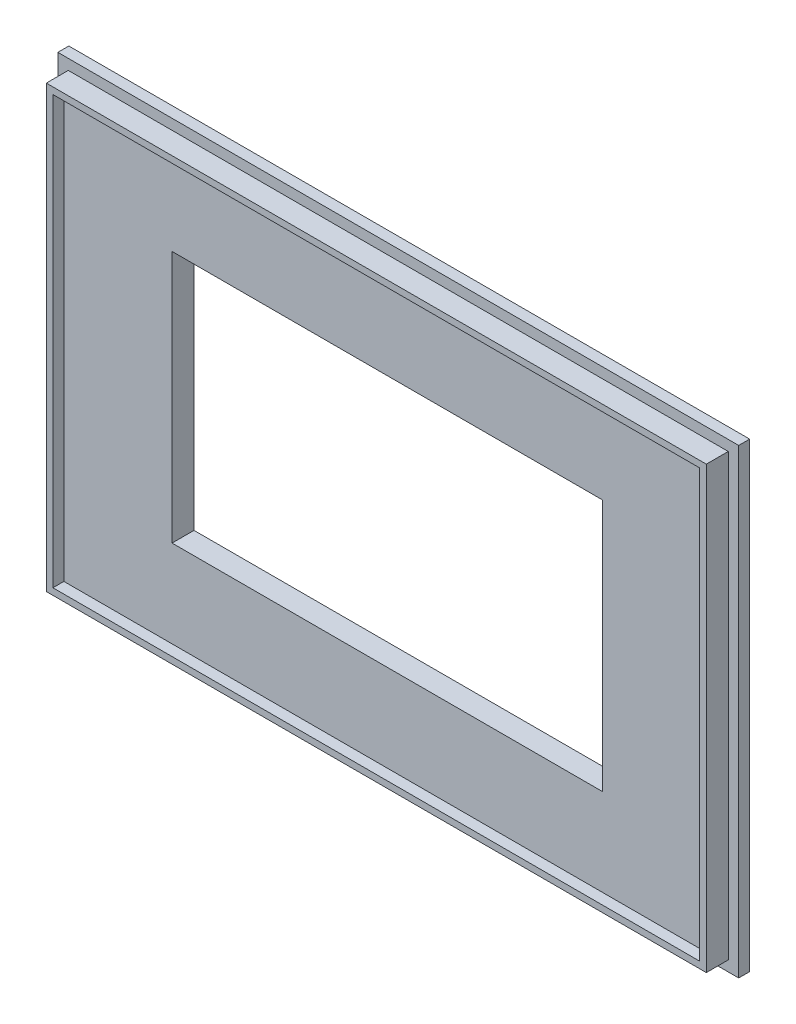
from build123d import *

# Parameters (mm, degrees)
SKETCH1_W           = 157.48
SKETCH1_H           = 106.68
BOSS_EXTRUDE1_DEPTH = 2.54
SKETCH2_W           = 152.654
SKETCH2_H           = 101.854
BOSS_EXTRUDE2_DEPTH = 5.08
SKETCH3_W           = 149.606
SKETCH3_H           = 98.806
CUT_EXTRUDE1_DEPTH  = 2.54
SKETCH4_W           = 99.568
SKETCH4_H           = 58.42
CUT_EXTRUDE2_DEPTH  = 96.241532957


with BuildPart() as part:
    # Sketch1 → Boss-Extrude1 (new body)
    with BuildSketch(Plane.XY):
        Rectangle(SKETCH1_W, SKETCH1_H)
    extrude(amount=BOSS_EXTRUDE1_DEPTH)

    # Sketch2 → Boss-Extrude2 (add)
    with BuildSketch(Plane.XY.offset(2.54)):
        Rectangle(SKETCH2_W, SKETCH2_H)
    extrude(amount=BOSS_EXTRUDE2_DEPTH)

    # Sketch3 → Cut-Extrude1 (cut)
    with BuildSketch(Plane.XY.offset(7.62)):
        Rectangle(SKETCH3_W, SKETCH3_H)
    extrude(amount=-CUT_EXTRUDE1_DEPTH, mode=Mode.SUBTRACT)

    # Sketch4 → Cut-Extrude2 (cut, through all)
    with BuildSketch(Plane.XY.offset(5.08)):
        Rectangle(SKETCH4_W, SKETCH4_H)
    extrude(amount=-CUT_EXTRUDE2_DEPTH, mode=Mode.SUBTRACT)


solid = part.part
